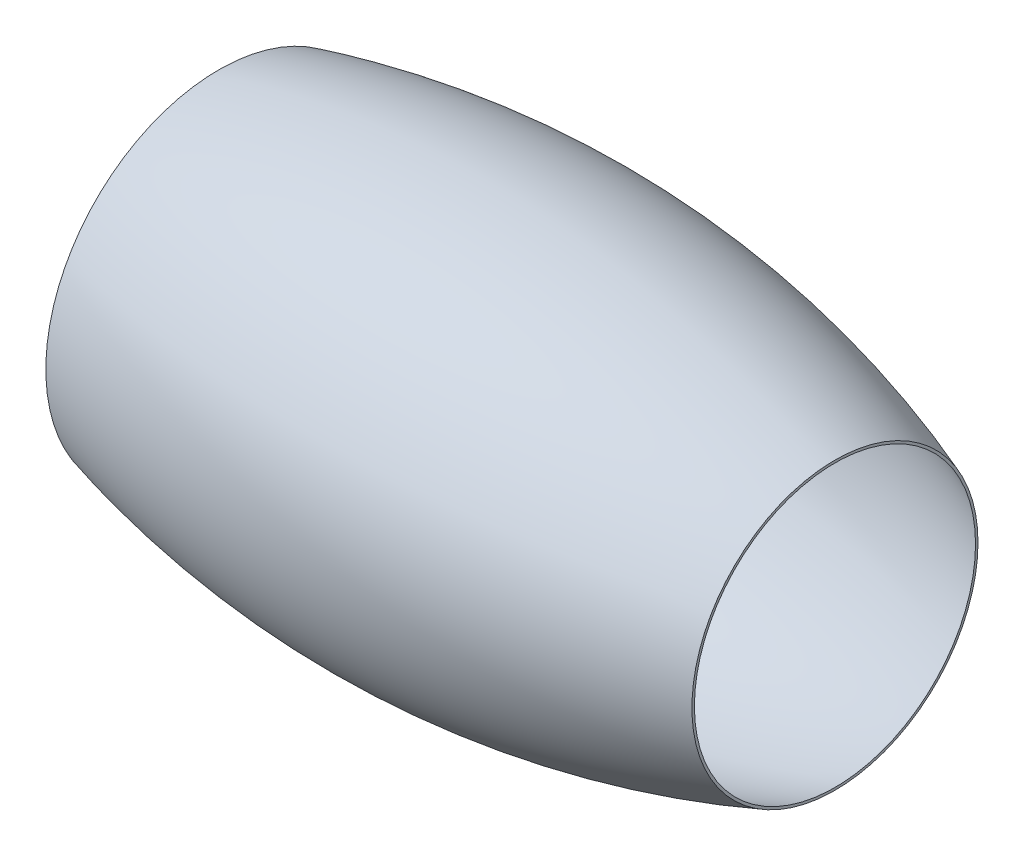
from build123d import *


with BuildPart() as part:
    # Sketch1 → Revolve2 (revolve)
    with BuildSketch(Plane.XY, mode=Mode.PRIVATE) as revolve2_sk:
        with BuildLine():
            Line((-1.890374856, 278.646084922), (-1.11391772, 275.748307443))
            ThreePointArc((-1.11391772, 275.748307443), (498.11595777, 327.807865041), (989.823619098, 226.99))
            Line((989.823619098, 226.99), (989.823619098, 230.99))
            ThreePointArc((989.823619098, 230.99), (496.057964386, 332.037925075), (-5.176380902, 279.318516526))
            Line((-5.176380902, 279.318516526), (-4.788152334, 277.869627786))
            Line((-4.788152334, 277.869627786), (-1.890374856, 278.646084922))
        make_face()
    revolve(revolve2_sk.sketch.rotate(Axis((135.597306746, 0, 0), (-1, 0, 0)), 90), axis=Axis((135.597306746, 0, 0), (-1, 0, 0)))


solid = part.part
